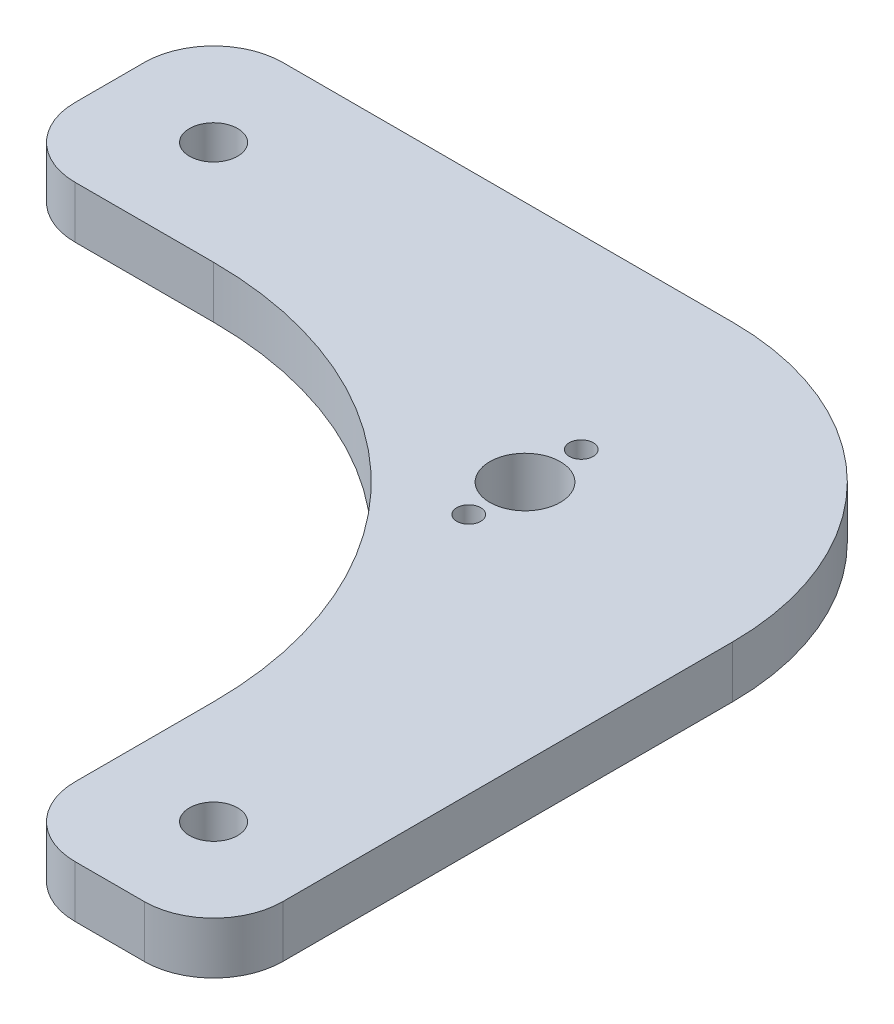
from build123d import *

# Parameters (mm, degrees)
SKETCH1_W                = 146.05
SKETCH1_H                = 146.05
BOSS_EXTRUDE1_DEPTH      = 4.7625
SKETCH2_R                = 6.477
SKETCH2_R_2              = 2.19075
CUT_EXTRUDE1_DEPTH       = 207.765399971
S_0_348_DIAMETER_HOLE1_D = 8.8392
CUT_EXTRUDE2_DEPTH       = 207.765399971
FILLET1_R                = 12.7
FILLET2_R                = 50.8


with BuildPart() as part:
    # Sketch1 → Boss-Extrude1 (new, symmetric)
    with BuildSketch(Plane(origin=(0, 0, 0), x_dir=(1, 0, 0), z_dir=(0, 1, 0))):
        with Locations((73.025, 73.025)):
            Rectangle(SKETCH1_W, SKETCH1_H)
    extrude(amount=BOSS_EXTRUDE1_DEPTH, both=True)

    # Sketch2 → Cut-Extrude1 (cut, through all)
    with BuildSketch(Plane(origin=(0, 4.7625, 0), x_dir=(1, 0, 0), z_dir=(0, 1, 0))):
        with Locations(Location((101.6, 101.6, 0), (0, 0, 270))):
            Circle(SKETCH2_R)
        with Locations(Location((101.6, 91.28125, 0), (0, 0, 270))):
            Circle(SKETCH2_R_2)
        with Locations(Location((101.6, 111.91875, 0), (0, 0, 270))):
            Circle(SKETCH2_R_2)
    extrude(amount=-CUT_EXTRUDE1_DEPTH, mode=Mode.SUBTRACT)

    # S (0.348) Diameter Hole1 (through all)
    with Locations(Plane(origin=(0, 4.7625, 0), x_dir=(1, 0, 0), z_dir=(0, 1, 0))):
        with Locations((19.05, 127), (127, 19.05), (57.15, 19.05), (19.05, 57.15)):
            Hole(S_0_348_DIAMETER_HOLE1_D / 2)

    # Sketch5 → Cut-Extrude2 (cut, through all)
    with BuildSketch(Plane(origin=(0, 4.7625, 0), x_dir=(1, 0, 0), z_dir=(0, 1, 0))):
        with BuildLine():
            Line((0, 107.95), (38.1, 107.95))
            ThreePointArc((38.1, 107.95), (87.491408666, 87.491408666), (107.95, 38.1))
            Line((107.95, 38.1), (107.95, 0))
            Line((107.95, 0), (0, 0))
            Line((0, 0), (0, 107.95))
        make_face()
    extrude(amount=-CUT_EXTRUDE2_DEPTH, mode=Mode.SUBTRACT)

    # Fillet1
    fillet1_edges = [part.edges().sort_by_distance(p)[0] for p in [
        (0, 0, -107.95),
        (107.95, 0, 0),
        (0, 0, -146.05),
        (146.05, 0, 0),
    ]]
    fillet(fillet1_edges, radius=FILLET1_R)

    # Fillet2
    fillet2_edges = [part.edges().sort_by_distance(p)[0] for p in [
        (146.05, 0, -146.05),
    ]]
    fillet(fillet2_edges, radius=FILLET2_R)


solid = part.part
